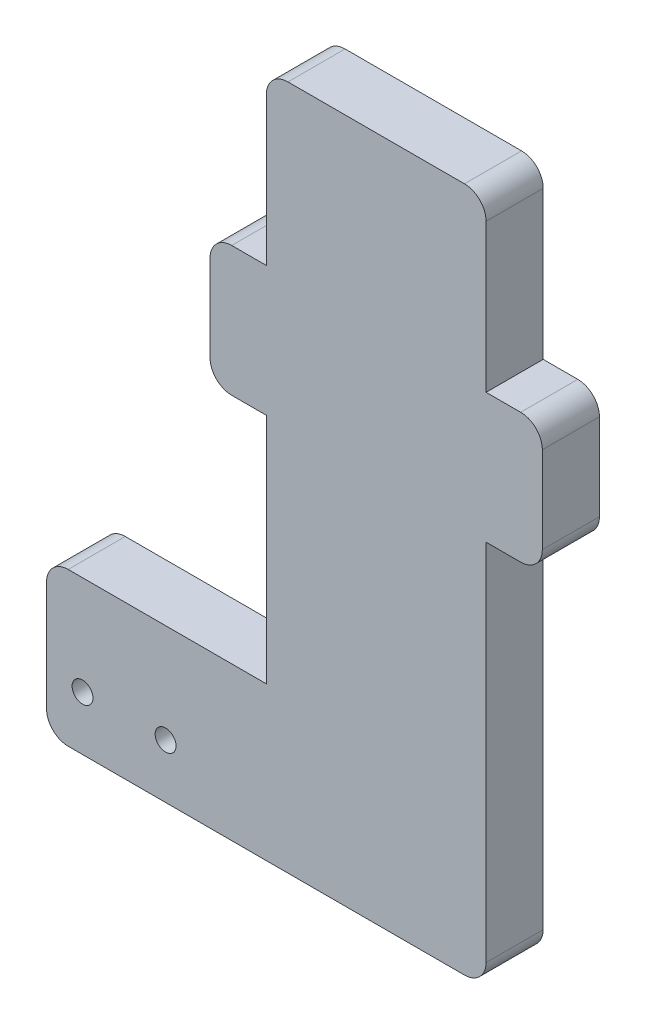
from build123d import *

# Parameters (mm, degrees)
MODEL_R             = 1.2065
BOSS_EXTRUDE1_DEPTH = 6.6


with BuildPart() as part:
    # Model → Boss-Extrude1 (new body)
    with BuildSketch(Plane.XY):
        with BuildLine():
            Line((-38.1, -33.25), (-38.1, -45.95))
            ThreePointArc((-38.1, -45.95), (-37.367766953, -47.717766953), (-35.6, -48.45))
            Line((-35.6, -48.45), (10.2, -48.45))
            ThreePointArc((10.2, -48.45), (11.967766953, -47.717766953), (12.7, -45.95))
            Line((12.7, -45.95), (12.7, -3.87))
            Line((12.7, -3.87), (16.7, -3.87))
            ThreePointArc((16.7, -3.87), (18.467766953, -3.137766953), (19.2, -1.37))
            Line((19.2, -1.37), (19.2, 8.63))
            ThreePointArc((19.2, 8.63), (18.467766953, 10.397766953), (16.7, 11.13))
            Line((16.7, 11.13), (12.7, 11.13))
            Line((12.7, 11.13), (12.7, 28.25))
            ThreePointArc((12.7, 28.25), (11.967766953, 30.017766953), (10.2, 30.75))
            Line((10.2, 30.75), (-10.2, 30.75))
            ThreePointArc((-10.2, 30.75), (-11.967766953, 30.017766953), (-12.7, 28.25))
            Line((-12.7, 28.25), (-12.7, 11.13))
            Line((-12.7, 11.13), (-16.7, 11.13))
            ThreePointArc((-16.7, 11.13), (-18.467766953, 10.397766953), (-19.2, 8.63))
            Line((-19.2, 8.63), (-19.2, -1.37))
            ThreePointArc((-19.2, -1.37), (-18.467766953, -3.137766953), (-16.7, -3.87))
            Line((-16.7, -3.87), (-12.7, -3.87))
            Line((-12.7, -3.87), (-12.7, -30.75))
            Line((-12.7, -30.75), (-35.6, -30.75))
            ThreePointArc((-35.6, -30.75), (-37.367766953, -31.482233047), (-38.1, -33.25))
        make_face()
        with Locations((-33.9438, -42.1983)):
            Circle(MODEL_R, mode=Mode.SUBTRACT)
        with Locations((-24.3426, -42.1983)):
            Circle(MODEL_R, mode=Mode.SUBTRACT)
    extrude(amount=BOSS_EXTRUDE1_DEPTH)


solid = part.part
